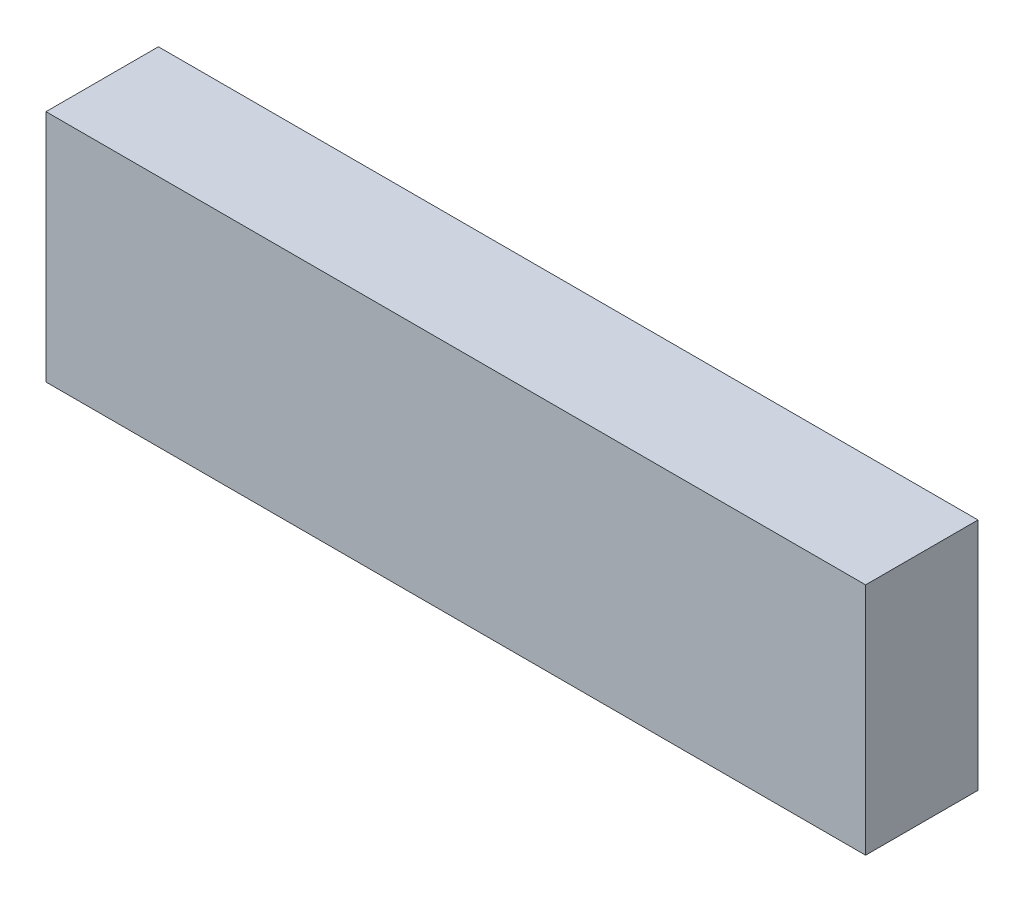
from build123d import *

# Parameters (mm, degrees)
SKETCH1_W           = 1.75
SKETCH1_H           = 0.5
BOSS_EXTRUDE1_DEPTH = 0.24


with BuildPart() as part:
    # Sketch1 → Boss-Extrude1 (new body)
    with BuildSketch(Plane.XY):
        with Locations((0.875, 0.25)):
            Rectangle(SKETCH1_W, SKETCH1_H)
    extrude(amount=BOSS_EXTRUDE1_DEPTH)


solid = part.part
